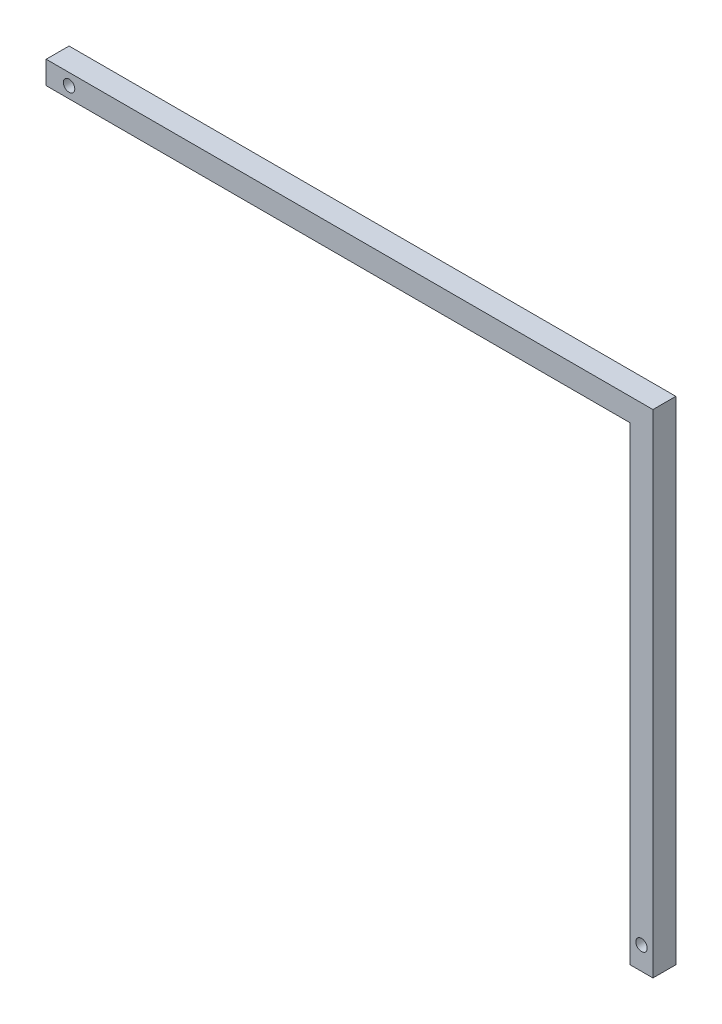
from build123d import *

# Parameters (mm, degrees)
SKETCH_1_W          = 510
SKETCH_1_H          = 20
SKETCH_1_R          = 5
SKETCH_1_W_2        = 20
SKETCH_1_H_2        = 410
EXTRUDE_1_DEPTH     = 20
SKETCH_2_R          = 5
CUT_EXTRUDE_1_DEPTH = 20


with BuildPart() as part:
    # Эскиз1 → Бобышка-Вытянуть1 (new body)
    # profile 1 of 3: a face of its own
    with BuildSketch(Plane.XY):
        with Locations((-10, 0)):
            Rectangle(SKETCH_1_W, SKETCH_1_H)
        with Locations((-245, 0)):
            Circle(SKETCH_1_R, mode=Mode.SUBTRACT)
    # profile 2 of 3: a face of its own
    with BuildSketch(Plane.XY):
        with Locations((255, 0)):
            Rectangle(SKETCH_1_W_2, SKETCH_1_H)
    # profile 3 of 3: a face of its own
    with BuildSketch(Plane.XY):
        with Locations((255, -215)):
            Rectangle(SKETCH_1_W_2, SKETCH_1_H_2)
    extrude(amount=EXTRUDE_1_DEPTH)

    # Эскиз2 → Вырез-Вытянуть1 (cut)
    with BuildSketch(Plane.XY.offset(20)):
        with Locations((255, -400)):
            Circle(SKETCH_2_R)
    extrude(amount=-CUT_EXTRUDE_1_DEPTH, mode=Mode.SUBTRACT)


solid = part.part
